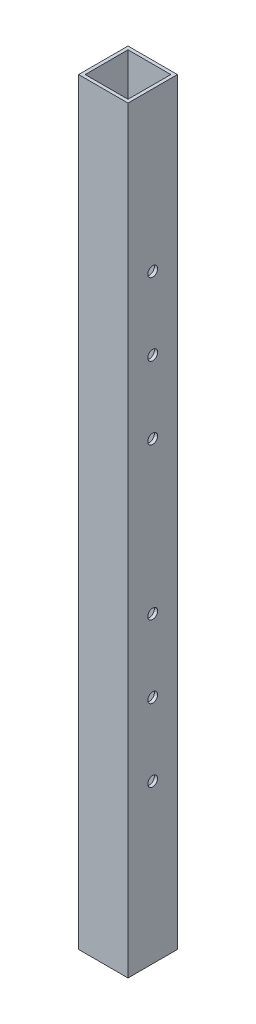
from build123d import *

# Parameters (mm, degrees)
SKETCH_1_W          = 15
SKETCH_1_H          = 15
SKETCH_1_W_2        = 13
SKETCH_1_H_2        = 13
EXTRUDE_1_DEPTH     = 230
SKETCH_2_R          = 1.5
CUT_EXTRUDE_1_DEPTH = 231.610602532


with BuildPart() as part:
    # 草图1 → 凸台-拉伸1 (new body)
    with BuildSketch(Plane(origin=(0, 0, 0), x_dir=(1, 0, 0), z_dir=(0, 1, 0))):
        Rectangle(SKETCH_1_W, SKETCH_1_H)
        Rectangle(SKETCH_1_W_2, SKETCH_1_H_2, mode=Mode.SUBTRACT)
    extrude(amount=EXTRUDE_1_DEPTH)

    # 草图2 → 切除-拉伸1 (cut, through all)
    with BuildSketch(Plane(origin=(7.5, 0, 0), x_dir=(0, 0, -1), z_dir=(1, 0, 0))):
        with Locations((0, 160)):
            Circle(SKETCH_2_R)
        with Locations((0, 138)):
            Circle(SKETCH_2_R)
        with Locations((0, 182)):
            Circle(SKETCH_2_R)
        with Locations(Location((0, 48, 0), (0, 0, 180))):
            Circle(SKETCH_2_R)
        with Locations(Location((0, 92, 0), (0, 0, 180))):
            Circle(SKETCH_2_R)
        with Locations(Location((0, 70, 0), (0, 0, 180))):
            Circle(SKETCH_2_R)
    extrude(amount=-CUT_EXTRUDE_1_DEPTH, mode=Mode.SUBTRACT)


solid = part.part
